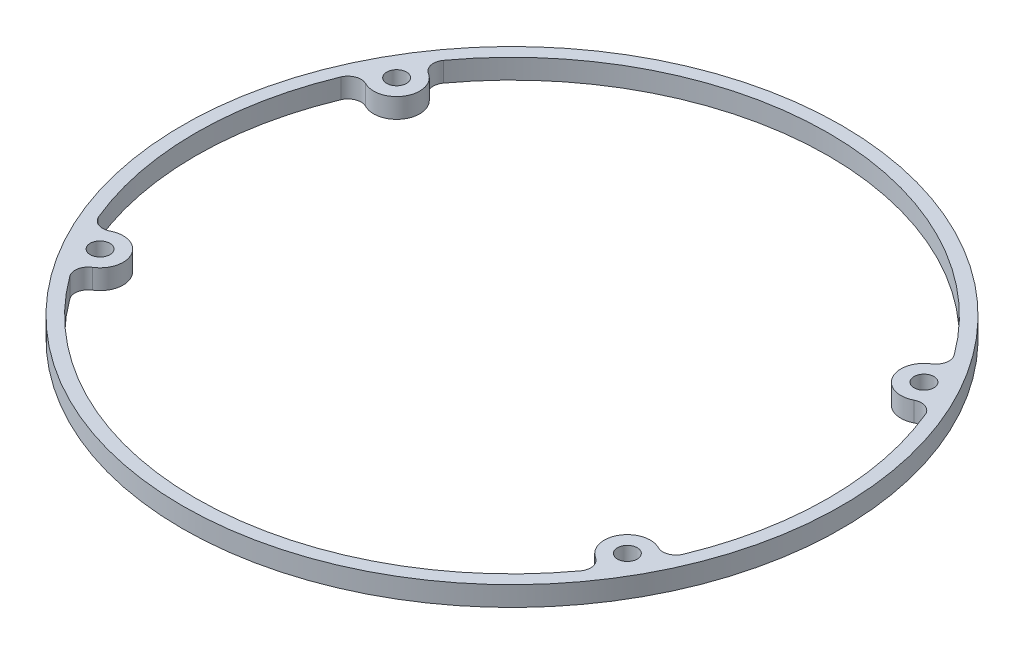
from build123d import *

# Parameters (mm, degrees)
SKETCH1_R           = 50
SKETCH1_R_2         = 1.5
BOSS_EXTRUDE1_DEPTH = 3
CUT_EXTRUDE1_DEPTH  = 71.774289117


with BuildPart() as part:
    # Sketch1 → Boss-Extrude1 (new body)
    with BuildSketch(Plane(origin=(0, 0, 0), x_dir=(1, 0, 0), z_dir=(0, 1, 0))):
        with Locations(Location((0, 0, 0), (0, 0, 270))):
            Circle(SKETCH1_R)
        with Locations(Location((-40, 22.5, 0), (0, 0, 270))):
            Circle(SKETCH1_R_2, mode=Mode.SUBTRACT)
        with Locations(Location((40, 22.5, 0), (0, 0, 270))):
            Circle(SKETCH1_R_2, mode=Mode.SUBTRACT)
        with Locations(Location((40, -22.5, 0), (0, 0, 270))):
            Circle(SKETCH1_R_2, mode=Mode.SUBTRACT)
        with Locations(Location((-40, -22.5, 0), (0, 0, 270))):
            Circle(SKETCH1_R_2, mode=Mode.SUBTRACT)
    extrude(amount=BOSS_EXTRUDE1_DEPTH)

    # Sketch2 → Cut-Extrude1 (cut, through all)
    with BuildSketch(Plane.XZ):
        with BuildLine():
            ThreePointArc((38.724655842, 28.361964493), (0, 48), (-38.724655842, 28.361964493))
            ThreePointArc((-38.724655842, 28.361964493), (-39.07406284, 26.796955174), (-38.161627237, 25.478319255))
            ThreePointArc((-38.161627237, 25.478319255), (-36.94948562, 20.784085661), (-41.590625258, 19.382322774))
            ThreePointArc((-41.590625258, 19.382322774), (-43.19134744, 19.477338108), (-44.347360672, 18.366044796))
            ThreePointArc((-44.347360672, 18.366044796), (-48, 0), (-44.347360672, -18.366044796))
            ThreePointArc((-44.347360672, -18.366044796), (-43.19134744, -19.477338108), (-41.590625258, -19.382322774))
            ThreePointArc((-41.590625258, -19.382322774), (-36.94948562, -20.784085661), (-38.161627237, -25.478319255))
            ThreePointArc((-38.161627237, -25.478319255), (-39.07406284, -26.796955174), (-38.724655842, -28.361964493))
            ThreePointArc((-38.724655842, -28.361964493), (0, -48), (38.724655842, -28.361964493))
            ThreePointArc((38.724655842, -28.361964493), (39.07406284, -26.796955174), (38.161627237, -25.478319255))
            ThreePointArc((38.161627237, -25.478319255), (36.94948562, -20.784085661), (41.590625258, -19.382322774))
            ThreePointArc((41.590625258, -19.382322774), (43.19134744, -19.477338108), (44.347360672, -18.366044796))
            ThreePointArc((44.347360672, -18.366044796), (48, 0), (44.347360672, 18.366044796))
            ThreePointArc((44.347360672, 18.366044796), (43.19134744, 19.477338108), (41.590625258, 19.382322774))
            ThreePointArc((41.590625258, 19.382322774), (36.94948562, 20.784085661), (38.161627237, 25.478319255))
            ThreePointArc((38.161627237, 25.478319255), (39.07406284, 26.796955174), (38.724655842, 28.361964493))
        make_face()
    extrude(amount=-CUT_EXTRUDE1_DEPTH, mode=Mode.SUBTRACT)


solid = part.part
